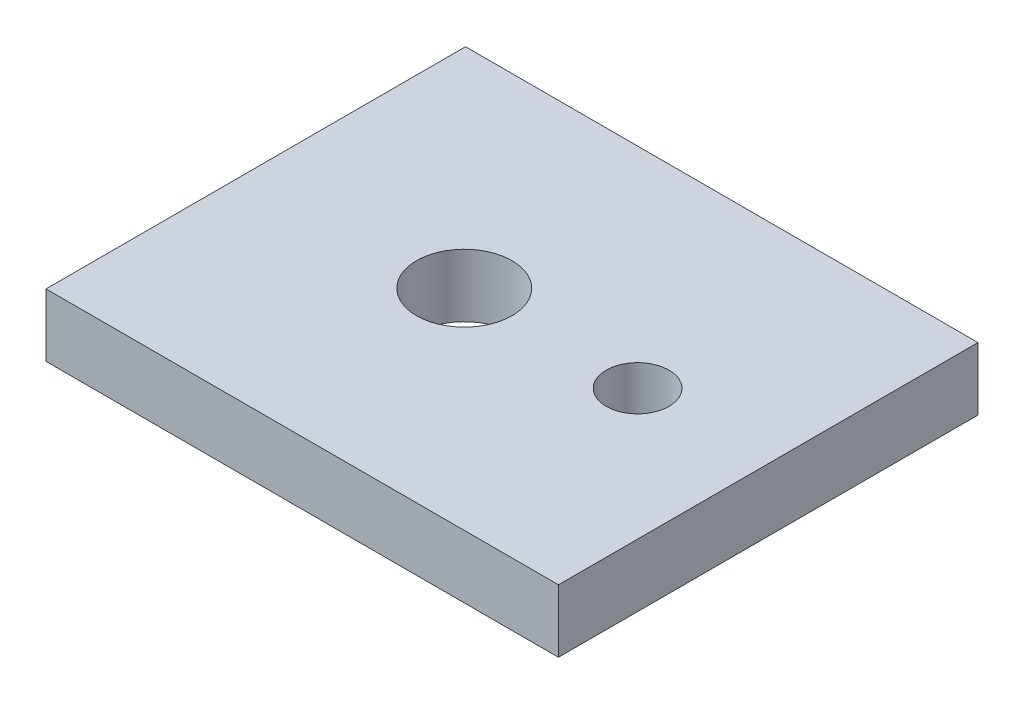
from build123d import *

# Parameters (mm, degrees)
SKETCH1_W           = 51.816
SKETCH1_H           = 42.418
SKETCH1_R           = 4.826
SKETCH1_R_2         = 3.175
BOSS_EXTRUDE1_DEPTH = 6.35


with BuildPart() as part:
    # Sketch1 → Boss-Extrude1 (new body)
    with BuildSketch(Plane(origin=(0, 0, 0), x_dir=(1, 0, 0), z_dir=(0, 1, 0))):
        with Locations((-25.908, 21.209)):
            Rectangle(SKETCH1_W, SKETCH1_H)
        with Locations(Location((-30.734, 21.209, 0), (0, 0, 270))):
            Circle(SKETCH1_R, mode=Mode.SUBTRACT)
        with Locations(Location((-13.208, 21.209, 0), (0, 0, 270))):
            Circle(SKETCH1_R_2, mode=Mode.SUBTRACT)
    extrude(amount=BOSS_EXTRUDE1_DEPTH)


solid = part.part
